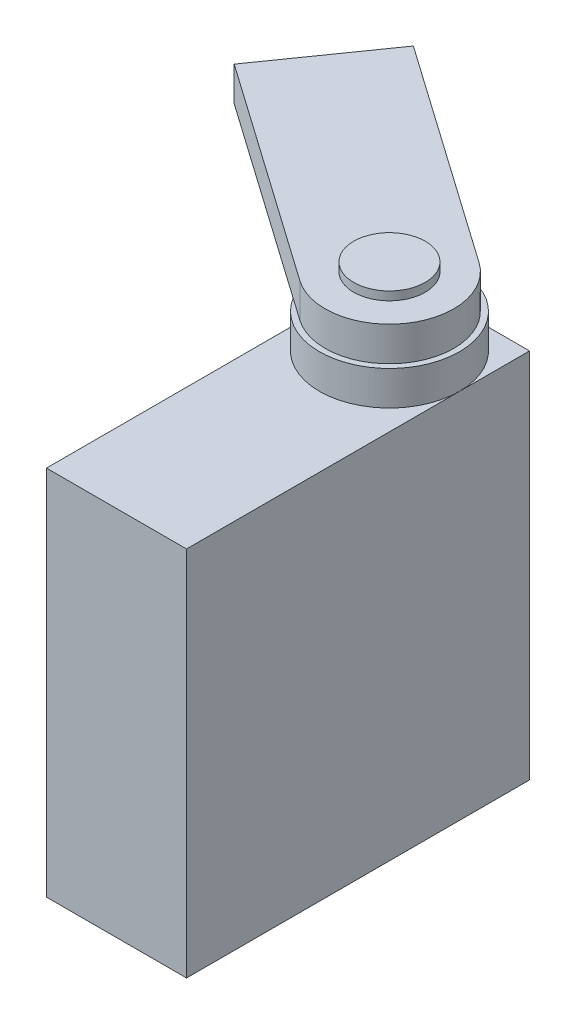
from build123d import *

# Parameters (mm, degrees)
SKETCH1_W           = 12.446
SKETCH1_H           = 33.02
BOSS_EXTRUDE1_DEPTH = 30.48
SKETCH3_R           = 6.223
BOSS_EXTRUDE2_DEPTH = 3.048
SKETCH4_R           = 3.175
BOSS_EXTRUDE3_DEPTH = 3.81
SKETCH5_R           = 5.715
SKETCH5_R_2         = 3.175
BOSS_EXTRUDE5_DEPTH = 3.048


with BuildPart() as part:
    # Sketch1 → Boss-Extrude1 (new body)
    with BuildSketch(Plane.XY):
        with Locations((6.223, 16.51)):
            Rectangle(SKETCH1_W, SKETCH1_H)
    extrude(amount=BOSS_EXTRUDE1_DEPTH)

    # Sketch3 → Boss-Extrude2 (add)
    with BuildSketch(Plane(origin=(0, 33.02, 0), x_dir=(1, 0, 0), z_dir=(0, 1, 0))):
        with Locations(Location((6.223, -6.223, 0), (0, 0, 90))):
            Circle(SKETCH3_R)
    extrude(amount=BOSS_EXTRUDE2_DEPTH)

    # Sketch4 → Boss-Extrude3 (add)
    with BuildSketch(Plane(origin=(0, 36.068, 0), x_dir=(1, 0, 0), z_dir=(0, 1, 0))):
        with Locations(Location((6.223, -6.223, 0), (0, 0, 90))):
            Circle(SKETCH4_R)
    extrude(amount=BOSS_EXTRUDE3_DEPTH)

    # Sketch5 → Boss-Extrude5 (add)
    # profile 1 of 3: a face of its own
    with BuildSketch(Plane(origin=(0, 36.068, 0), x_dir=(1, 0, 0), z_dir=(0, 1, 0))):
        with Locations((6.223, -6.223)):
            Circle(SKETCH5_R)
        with Locations(Location((6.223, -6.223, 0), (0, 0, 90))):
            Circle(SKETCH5_R_2, mode=Mode.SUBTRACT)
    # profile 2 of 3: a face of its own
    with BuildSketch(Plane(origin=(0, 36.068, 0), x_dir=(1, 0, 0), z_dir=(0, 1, 0))):
        with BuildLine():
            ThreePointArc((0.923781736, -9.485516634), (1.129757079, -2.647443323), (7.491130735, -0.130580658))
            Line((7.491130735, -0.130580658), (-10.085283199, 12.208407524))
            Line((-10.085283199, 12.208407524), (-16.652632198, 2.853471548))
            Line((-16.652632198, 2.853471548), (0.923781736, -9.485516634))
        make_face()
    # profile 3 of 3: a face of its own
    with BuildSketch(Plane(origin=(0, 36.068, 0), x_dir=(1, 0, 0), z_dir=(0, 1, 0))):
        with BuildLine():
            ThreePointArc((2.9393255, -10.900467988), (1.545532012, -2.9393255), (9.5066745, -1.545532012))
            Line((9.5066745, -1.545532012), (7.491130735, -0.130580658))
            ThreePointArc((7.491130735, -0.130580658), (1.129757079, -2.647443323), (0.923781736, -9.485516634))
            Line((0.923781736, -9.485516634), (2.9393255, -10.900467988))
        make_face()
    extrude(amount=BOSS_EXTRUDE5_DEPTH)


solid = part.part
